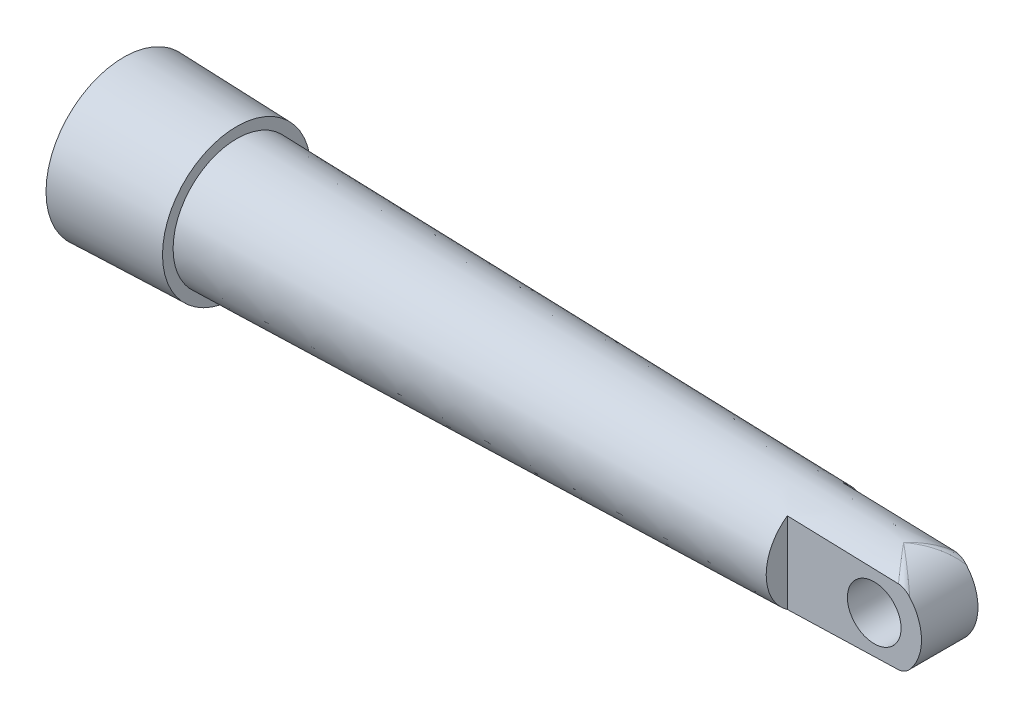
from build123d import *
from build123d.topology import SkipClean

# Parameters (mm, degrees)
BOSS_EXTRUDE1_DEPTH = 1
SKETCH5_R           = 0.9500000000000008
CUT_EXTRUDE1_DEPTH  = 2
FILLET1_R           = 0.3
SKETCH6_R           = 1
CUT_EXTRUDE2_DEPTH  = 15


with BuildPart() as part:
    # Sketch2 → Revolve1 (revolve)
    with BuildSketch(Plane.XY, mode=Mode.PRIVATE) as revolve1_sk:
        Polygon((0, 0), (0, 2.75), (4, 2.625), (4, 2.25), (24.5, 1.75), (24.5, 0), align=None)
    revolve(revolve1_sk.sketch.rotate(Axis((0, 0, 0), (1, 0, 0)), 90), axis=Axis((0, 0, 0), (1, 0, 0)))

    # Sketch3 → Boss-Extrude1 (add, symmetric)
    with BuildSketch(Plane.XY):
        with BuildLine():
            Line((24.5, 1.75), (24.5, -1.75))
            Line((24.5, -1.75), (27.61633950553443, -1.673991719377209))
            ThreePointArc((27.61633950553443, -1.673991719377209), (29.24999999999989, -1.262e-14), (27.61633950553443, 1.6739917193771834))
            Line((27.61633950553443, 1.6739917193771834), (24.5, 1.75))
        make_face()
    extrude(amount=BOSS_EXTRUDE1_DEPTH, both=True)

    # Sketch4 → Cut-Revolve1 (revolve, cut)
    with SkipClean():  # the faces are left unmerged after this step: merging them gives an invalid solid
        with BuildSketch(Plane.XY):
            Polygon((24.5, 1.75), (30.062821942046543, 1.6143214160476007), (30.062821942046543, 2.5), (24.5, 2.5), align=None)
        revolve(axis=Axis((24.5, 4.3e-16, 0), (1, -3e-16, 0)), mode=Mode.SUBTRACT)

    # Sketch5 → Cut-Extrude1 (cut)
    with SkipClean():  # the faces are left unmerged after this step: merging them gives an invalid solid
        with BuildSketch(Plane.XY.offset(1)):
            with Locations((27.575510439208156, -1.262e-14)):
                Circle(SKETCH5_R)
        extrude(amount=-CUT_EXTRUDE1_DEPTH, mode=Mode.SUBTRACT)

    # Fillet1
    fillet1_edges = [part.edges().sort_by_distance(p)[0] for p in [
        (28.132039020152703, 1.5793008628168437, -0.5158528825070366),
        (28.132039019923862, -1.579300862247398, -0.5158528822781783),
        (28.1320390201527, 1.579300862816838, 0.5158528825070365),
        (28.132039019899718, -1.5793008622559224, 0.5158528822537949),
    ]]
    fillet(fillet1_edges, radius=FILLET1_R)

    # Sketch6 → Cut-Extrude2 (cut)
    with SkipClean():  # the faces are left unmerged after this step: merging them gives an invalid solid
        with BuildSketch(Plane.ZY):
            Circle(SKETCH6_R)
        extrude(amount=-CUT_EXTRUDE2_DEPTH, mode=Mode.SUBTRACT)


solid = part.part
